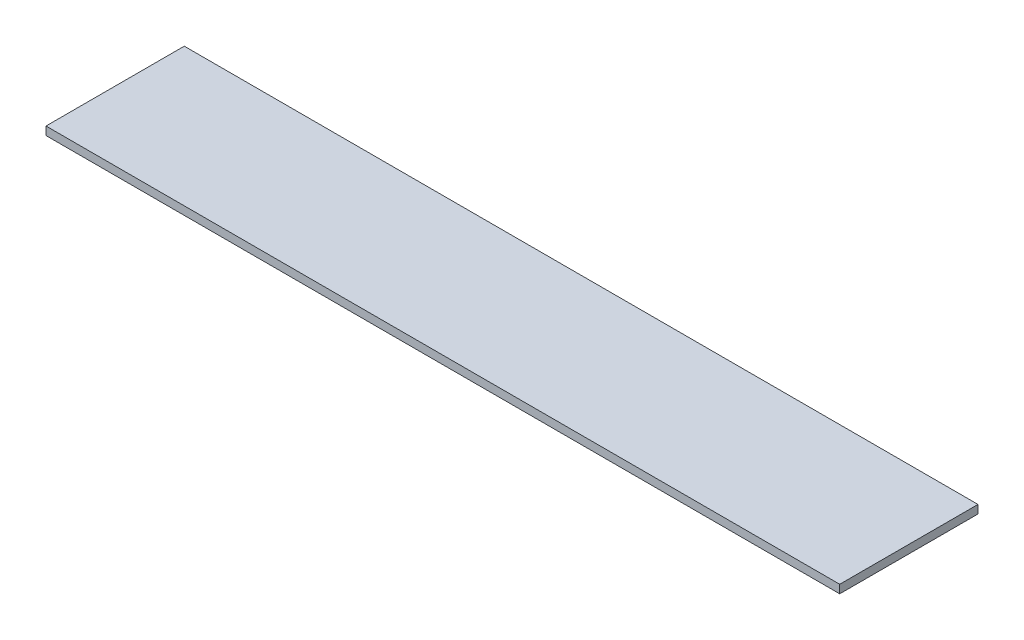
from build123d import *

# Parameters (mm, degrees)
SKETCH1_W           = 287
SKETCH1_H           = 50
BOSS_EXTRUDE1_DEPTH = 3


with BuildPart() as part:
    # Sketch1 → Boss-Extrude1 (new body)
    with BuildSketch(Plane(origin=(0, 0, 0), x_dir=(1, 0, 0), z_dir=(0, 1, 0))):
        Rectangle(SKETCH1_W, SKETCH1_H)
    extrude(amount=BOSS_EXTRUDE1_DEPTH)


solid = part.part
